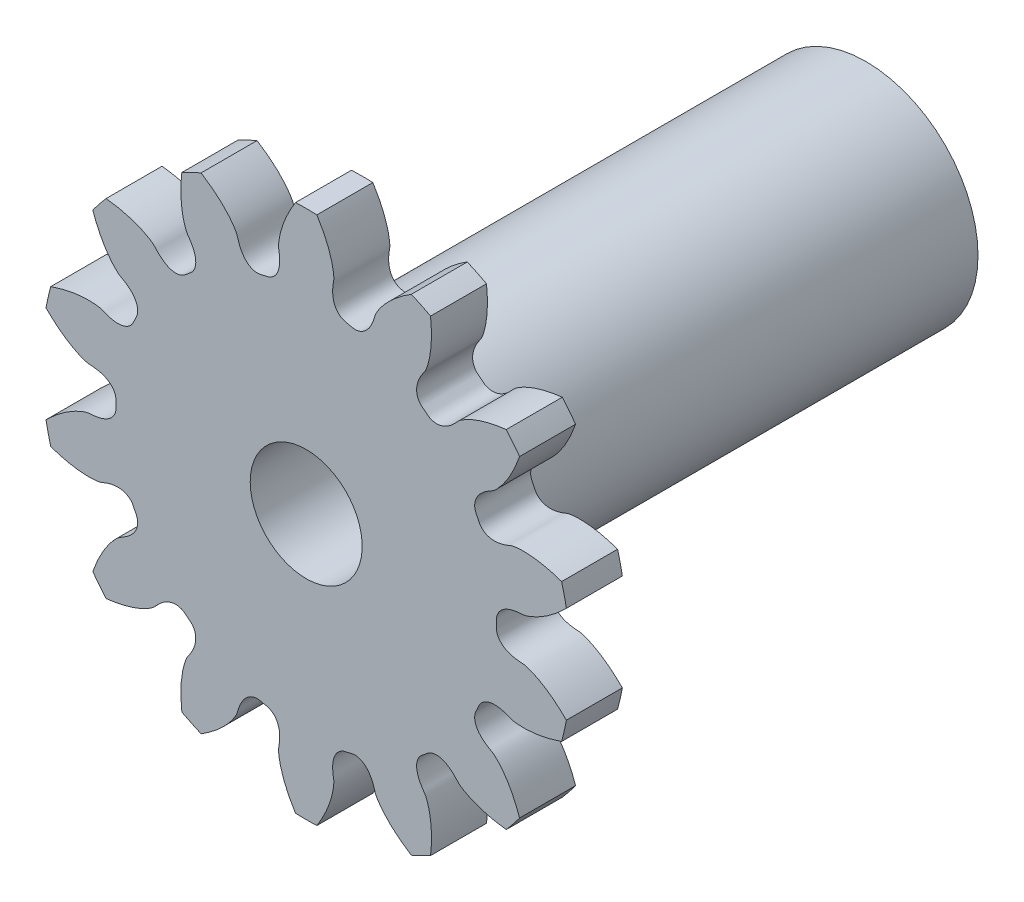
from build123d import *

# Parameters (mm, degrees)
SKETCHREVOLVESPUR02_W       = 0.25
SKETCHREVOLVESPUR02_H       = 1.181818182
TOOTHEXTRUDECUTSPUR02_DEPTH = 0.5
PATTERNSPUR02_COUNT         = 14
CROQUIS5_R                  = 0.5
CROQUIS5_R_2                = 0.25
SALIENTE_EXTRUIR5_DEPTH     = 2.25
CROQUIS6_R                  = 0.25
CORTAR_EXTRUIR1_DEPTH       = 3.794480396


with BuildPart() as part:
    # SketchRevolveSpur02 → Spur02 (revolve)
    with BuildSketch(Plane(origin=(0, 0, 0), x_dir=(0, 0, -1), z_dir=(1, 0, 0))):
        with Locations((-0.375, 0.590909091)):
            Rectangle(SKETCHREVOLVESPUR02_W, SKETCHREVOLVESPUR02_H)
    revolve(axis=Axis((0, 0, 0), (0, 0, -1)))

    # SketchToothSpur02 → ToothExtrudeCutSpur02 (cut, symmetric)
    with BuildSketch(Plane.XY):
        with BuildLine():
            ThreePointArc((1.168166232, 0.222699585), (1.189204545, 0), (1.168166232, -0.222699585))
            add(Edge.make_bspline(
                [(1.168166232, -0.222699585), (1.157526693, -0.211684751), (1.141448723, -0.196113102), (1.119536083, -0.177083647), (1.104019508, -0.164539924), (1.089037225, -0.153277276), (1.074659082, -0.143241531), (1.060951743, -0.134375204), (1.047978541, -0.126617668), (1.035799328, -0.11990538), (1.024470395, -0.114171835), (1.014044202, -0.109348446), (1.004569732, -0.105362463), (0.996090914, -0.10214429), (0.988651074, -0.099605674), (0.982279184, -0.097705949), (0.973761475, -0.095361705), (0.964441247, -0.094387793), (0.954328691, -0.094070483), (0.946474335, -0.093365851), (0.938862921, -0.092446816), (0.93149177, -0.091254703), (0.924357399, -0.089804054), (0.917455085, -0.088087315), (0.910779072, -0.086098447), (0.904322788, -0.083825668), (0.898079373, -0.081251883), (0.892042634, -0.078352832), (0.886208703, -0.075095586), (0.880578769, -0.071436934), (0.875163349, -0.067322272), (0.869988625, -0.06268588), (0.865104878, -0.05745421), (0.860596959, -0.051554421), (0.856591364, -0.044931062), (0.853264922, -0.037570367), (0.85080456, -0.029533856), (0.849605179, -0.021771772), (0.849104735, -0.011876995), (0.849659093, 0), (0.849104735, 0.011876995), (0.849605179, 0.021771772), (0.85080456, 0.029533856), (0.853264922, 0.037570367), (0.856591364, 0.044931062), (0.860596959, 0.051554421), (0.865104878, 0.05745421), (0.869988625, 0.06268588), (0.875163349, 0.067322272), (0.880578769, 0.071436934), (0.886208703, 0.075095586), (0.892042634, 0.078352832), (0.898079373, 0.081251883), (0.904322788, 0.083825668), (0.910779072, 0.086098447), (0.917455085, 0.088087315), (0.924357399, 0.089804054), (0.93149177, 0.091254703), (0.938862921, 0.092446816), (0.946474335, 0.093365851), (0.954328691, 0.094070483), (0.964441247, 0.094387793), (0.973761475, 0.095361705), (0.982279184, 0.097705949), (0.988651074, 0.099605674), (0.996090914, 0.10214429), (1.004569732, 0.105362463), (1.014044202, 0.109348446), (1.024470395, 0.114171835), (1.035799328, 0.11990538), (1.047978541, 0.126617668), (1.060951743, 0.134375204), (1.074659082, 0.143241531), (1.089037225, 0.153277276), (1.104019508, 0.164539924), (1.119536083, 0.177083647), (1.141448723, 0.196113102), (1.157526693, 0.211684751), (1.168166232, 0.222699585)],
                knots=[0, 0, 0, 0, 0.055400431, 0.080913787, 0.104969238, 0.127566782, 0.148706421, 0.168388153, 0.186611979, 0.203377899, 0.218685914, 0.232536022, 0.244928224, 0.25586252, 0.265338911, 0.273357395, 0.279917974, 0.297271865, 0.307043535, 0.316542256, 0.325781412, 0.334776637, 0.343546256, 0.352111828, 0.360498786, 0.368737192, 0.376862595, 0.384916961, 0.39294958, 0.401017761, 0.409186971, 0.417529793, 0.426122804, 0.435040151, 0.444342783, 0.454063318, 0.464189245, 0.474650871, 0.48238604, 0.5, 0.51761396, 0.525349129, 0.535810755, 0.545936682, 0.555657217, 0.564959849, 0.573877196, 0.582470207, 0.590813029, 0.598982239, 0.60705042, 0.615083039, 0.623137405, 0.631262808, 0.639501214, 0.647888172, 0.656453744, 0.665223363, 0.674218588, 0.683457744, 0.692956465, 0.702728135, 0.720082026, 0.726642605, 0.734661089, 0.74413748, 0.755071776, 0.767463978, 0.781314086, 0.796622101, 0.813388021, 0.831611847, 0.851293579, 0.872433218, 0.895030762, 0.919086213, 0.944599569, 1, 1, 1, 1], degree=3))
        make_face()
    toothextrudecutspur02 = extrude(amount=TOOTHEXTRUDECUTSPUR02_DEPTH, both=True, mode=Mode.SUBTRACT)

    # PatternSpur02: ToothExtrudeCutSpur02 ×14 about axis
    patternspur02_axis = Axis((0, 0, 55), (0, 0, -1))
    for i in range(1, PATTERNSPUR02_COUNT):
        add(toothextrudecutspur02.rotate(patternspur02_axis, i * 360 / PATTERNSPUR02_COUNT), mode=Mode.SUBTRACT)

    # Croquis5 → Saliente-Extruir5 (add)
    with BuildSketch(Plane(origin=(0, 0, 0.25), x_dir=(-1, 0, 0), z_dir=(0, 0, -1))):
        Circle(CROQUIS5_R)
        Circle(CROQUIS5_R_2, mode=Mode.SUBTRACT)
    extrude(amount=SALIENTE_EXTRUIR5_DEPTH)

    # Croquis6 → Cortar-Extruir1 (cut, through all)
    with BuildSketch(Plane(origin=(0, 0, 0.25), x_dir=(-1, 0, 0), z_dir=(0, 0, -1))):
        Circle(CROQUIS6_R)
    extrude(amount=-CORTAR_EXTRUIR1_DEPTH, mode=Mode.SUBTRACT)


solid = part.part
